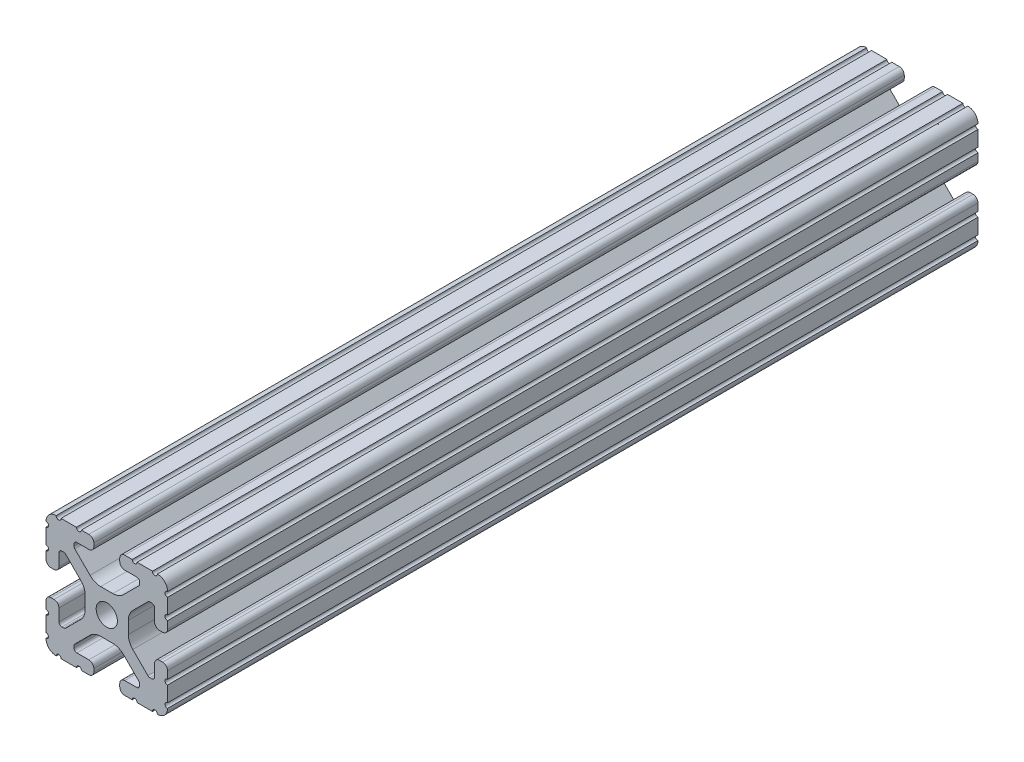
from build123d import *

# Parameters (mm, degrees)
SKETCH1_R      = 3.3274
EXTRUDE1_DEPTH = 254


with BuildPart() as part:
    # Sketch1 → Extrude1 (new body)
    with BuildSketch(Plane.XY):
        with BuildLine():
            Line((-10.022898969, 12.91475973), (-5.252158105, 8.144007132))
            ThreePointArc((-5.252158105, 8.144007132), (-3.715177372, 7.117027388), (-1.902183975, 6.7564))
            Line((-1.902183975, 6.7564), (1.902183975, 6.7564))
            ThreePointArc((1.902183975, 6.7564), (3.715177372, 7.117027388), (5.252158105, 8.144007132))
            Line((5.252158105, 8.144007132), (10.022898969, 12.91475973))
            ThreePointArc((10.022898969, 12.91475973), (10.218362387, 13.207291992), (10.287, 13.552357131))
            Line((10.287, 13.552357131), (10.287, 14.0843))
            ThreePointArc((10.287, 14.0843), (10.022898185, 14.721898185), (9.3853, 14.986))
            Line((9.3853, 14.986), (5.617617549, 14.986))
            ThreePointArc((5.617617549, 14.986), (4.519044045, 15.441044045), (4.064, 16.539617549))
            Line((4.064, 16.539617549), (4.064, 17.496382451))
            ThreePointArc((4.064, 17.496382451), (4.519044045, 18.594955955), (5.617617549, 19.05))
            Line((5.617617549, 19.05), (7.974178704, 19.05))
            ThreePointArc((7.974178704, 19.05), (8.736178704, 18.288), (9.498178704, 19.05))
            Line((9.498178704, 19.05), (14.327719207, 19.05))
            ThreePointArc((14.327719207, 19.05), (15.087603123, 18.231251131), (15.847487039, 19.05))
            ThreePointArc((15.847487039, 19.05), (18.120176289, 18.120192083), (19.05, 15.847509295))
            ThreePointArc((19.05, 15.847509295), (18.231250992, 15.08762539), (19.05, 14.327741484))
            Line((19.05, 14.327741484), (19.05, 9.496091471))
            ThreePointArc((19.05, 9.496091471), (18.231250992, 8.736207565), (19.05, 7.97632366))
            Line((19.05, 7.97632366), (19.05, 5.617617549))
            ThreePointArc((19.05, 5.617617549), (18.594955955, 4.519044045), (17.496382451, 4.064))
            Line((17.496382451, 4.064), (16.539617549, 4.064))
            ThreePointArc((16.539617549, 4.064), (15.441044045, 4.519044045), (14.986, 5.617617549))
            Line((14.986, 5.617617549), (14.986, 9.385342516))
            ThreePointArc((14.986, 9.385342516), (14.721898185, 10.022940701), (14.0843, 10.287042516))
            Line((14.0843, 10.287042516), (13.516042086, 10.287042516))
            ThreePointArc((13.516042086, 10.287042516), (13.170975923, 10.218404478), (12.878443117, 10.022939917))
            Line((12.878443117, 10.022939917), (8.14758008, 5.292065243))
            ThreePointArc((8.14758008, 5.292065243), (7.117955879, 3.751120653), (6.7564, 1.933453584))
            Line((6.7564, 1.933453584), (6.7564, -1.933453584))
            ThreePointArc((6.7564, -1.933453584), (7.117955879, -3.751120653), (8.14758008, -5.292065243))
            Line((8.14758008, -5.292065243), (12.878443117, -10.022939917))
            ThreePointArc((12.878443117, -10.022939917), (13.170975923, -10.218404478), (13.516042086, -10.287042516))
            Line((13.516042086, -10.287042516), (14.0843, -10.287042516))
            ThreePointArc((14.0843, -10.287042516), (14.721898185, -10.022940701), (14.986, -9.385342516))
            Line((14.986, -9.385342516), (14.986, -5.617617549))
            ThreePointArc((14.986, -5.617617549), (15.441044045, -4.519044045), (16.539617549, -4.064))
            Line((16.539617549, -4.064), (17.496382451, -4.064))
            ThreePointArc((17.496382451, -4.064), (18.594955955, -4.519044045), (19.05, -5.617617549))
            Line((19.05, -5.617617549), (19.05, -7.976318491))
            ThreePointArc((19.05, -7.976318491), (18.231250992, -8.736202396), (19.05, -9.496086302))
            Line((19.05, -9.496086302), (19.05, -14.32774291))
            ThreePointArc((19.05, -14.32774291), (18.231250992, -15.087626816), (19.05, -15.847510721))
            ThreePointArc((19.05, -15.847510721), (18.120175716, -18.120192644), (15.847486868, -19.05))
            ThreePointArc((15.847486868, -19.05), (15.087602952, -18.231251131), (14.327719036, -19.05))
            Line((14.327719036, -19.05), (9.496062448, -19.05))
            ThreePointArc((9.496062448, -19.05), (8.736178532, -18.231251131), (7.976294616, -19.05))
            Line((7.976294616, -19.05), (5.617617549, -19.05))
            ThreePointArc((5.617617549, -19.05), (4.519044045, -18.594955955), (4.064, -17.496382451))
            Line((4.064, -17.496382451), (4.064, -16.539617549))
            ThreePointArc((4.064, -16.539617549), (4.519044045, -15.441044045), (5.617617549, -14.986))
            Line((5.617617549, -14.986), (9.3853, -14.986))
            ThreePointArc((9.3853, -14.986), (10.022898185, -14.721898185), (10.287, -14.0843))
            Line((10.287, -14.0843), (10.287, -13.552357131))
            ThreePointArc((10.287, -13.552357131), (10.218362387, -13.207291992), (10.022898969, -12.91475973))
            Line((10.022898969, -12.91475973), (5.252158105, -8.144007132))
            ThreePointArc((5.252158105, -8.144007132), (3.715177372, -7.117027388), (1.902183975, -6.7564))
            Line((1.902183975, -6.7564), (-1.902183975, -6.7564))
            ThreePointArc((-1.902183975, -6.7564), (-3.715177372, -7.117027388), (-5.252158105, -8.144007132))
            Line((-5.252158105, -8.144007132), (-10.022898969, -12.91475973))
            ThreePointArc((-10.022898969, -12.91475973), (-10.218362387, -13.207291992), (-10.287, -13.552357131))
            Line((-10.287, -13.552357131), (-10.287, -14.0843))
            ThreePointArc((-10.287, -14.0843), (-10.022898185, -14.721898185), (-9.3853, -14.986))
            Line((-9.3853, -14.986), (-5.617617549, -14.986))
            ThreePointArc((-5.617617549, -14.986), (-4.519044045, -15.441044045), (-4.064, -16.539617549))
            Line((-4.064, -16.539617549), (-4.064, -17.496382451))
            ThreePointArc((-4.064, -17.496382451), (-4.519044045, -18.594955955), (-5.617617549, -19.05))
            Line((-5.617617549, -19.05), (-7.976294616, -19.05))
            ThreePointArc((-7.976294616, -19.05), (-8.736178532, -18.231251131), (-9.496062448, -19.05))
            Line((-9.496062448, -19.05), (-14.327719036, -19.05))
            ThreePointArc((-14.327719036, -19.05), (-15.087602952, -18.231251131), (-15.847486868, -19.05))
            ThreePointArc((-15.847486868, -19.05), (-18.120175716, -18.120192644), (-19.05, -15.847510721))
            ThreePointArc((-19.05, -15.847510721), (-18.231250992, -15.087626816), (-19.05, -14.32774291))
            Line((-19.05, -14.32774291), (-19.05, -9.496086302))
            ThreePointArc((-19.05, -9.496086302), (-18.231250992, -8.736202396), (-19.05, -7.976318491))
            Line((-19.05, -7.976318491), (-19.05, -5.617617549))
            ThreePointArc((-19.05, -5.617617549), (-18.594955955, -4.519044045), (-17.496382451, -4.064))
            Line((-17.496382451, -4.064), (-16.539617549, -4.064))
            ThreePointArc((-16.539617549, -4.064), (-15.441044045, -4.519044045), (-14.986, -5.617617549))
            Line((-14.986, -5.617617549), (-14.986, -9.385342516))
            ThreePointArc((-14.986, -9.385342516), (-14.721898185, -10.022940701), (-14.0843, -10.287042516))
            Line((-14.0843, -10.287042516), (-13.516042086, -10.287042516))
            ThreePointArc((-13.516042086, -10.287042516), (-13.170975923, -10.218404478), (-12.878443117, -10.022939917))
            Line((-12.878443117, -10.022939917), (-8.14758008, -5.292065243))
            ThreePointArc((-8.14758008, -5.292065243), (-7.117955879, -3.751120653), (-6.7564, -1.933453584))
            Line((-6.7564, -1.933453584), (-6.7564, 1.933453584))
            ThreePointArc((-6.7564, 1.933453584), (-7.117955879, 3.751120653), (-8.14758008, 5.292065243))
            Line((-8.14758008, 5.292065243), (-12.878443117, 10.022939917))
            ThreePointArc((-12.878443117, 10.022939917), (-13.170975923, 10.218404478), (-13.516042086, 10.287042516))
            Line((-13.516042086, 10.287042516), (-14.0843, 10.287042516))
            ThreePointArc((-14.0843, 10.287042516), (-14.721898185, 10.022940701), (-14.986, 9.385342516))
            Line((-14.986, 9.385342516), (-14.986, 5.617617549))
            ThreePointArc((-14.986, 5.617617549), (-15.441044045, 4.519044045), (-16.539617549, 4.064))
            Line((-16.539617549, 4.064), (-17.496382451, 4.064))
            ThreePointArc((-17.496382451, 4.064), (-18.594955955, 4.519044045), (-19.05, 5.617617549))
            Line((-19.05, 5.617617549), (-19.05, 7.97632366))
            ThreePointArc((-19.05, 7.97632366), (-18.231250992, 8.736207565), (-19.05, 9.496091471))
            Line((-19.05, 9.496091471), (-19.05, 14.327741484))
            ThreePointArc((-19.05, 14.327741484), (-18.231250992, 15.08762539), (-19.05, 15.847509295))
            ThreePointArc((-19.05, 15.847509295), (-18.120176289, 18.120192083), (-15.847487039, 19.05))
            ThreePointArc((-15.847487039, 19.05), (-15.087603123, 18.231251131), (-14.327719207, 19.05))
            Line((-14.327719207, 19.05), (-9.498178704, 19.05))
            ThreePointArc((-9.498178704, 19.05), (-8.736178704, 18.288), (-7.974178704, 19.05))
            Line((-7.974178704, 19.05), (-5.617617549, 19.05))
            ThreePointArc((-5.617617549, 19.05), (-4.519044045, 18.594955955), (-4.064, 17.496382451))
            Line((-4.064, 17.496382451), (-4.064, 16.539617549))
            ThreePointArc((-4.064, 16.539617549), (-4.519044045, 15.441044045), (-5.617617549, 14.986))
            Line((-5.617617549, 14.986), (-9.3853, 14.986))
            ThreePointArc((-9.3853, 14.986), (-10.022898185, 14.721898185), (-10.287, 14.0843))
            Line((-10.287, 14.0843), (-10.287, 13.552357131))
            ThreePointArc((-10.287, 13.552357131), (-10.218362387, 13.207291992), (-10.022898969, 12.91475973))
        make_face()
        Circle(SKETCH1_R, mode=Mode.SUBTRACT)
    extrude(amount=-EXTRUDE1_DEPTH)


solid = part.part
